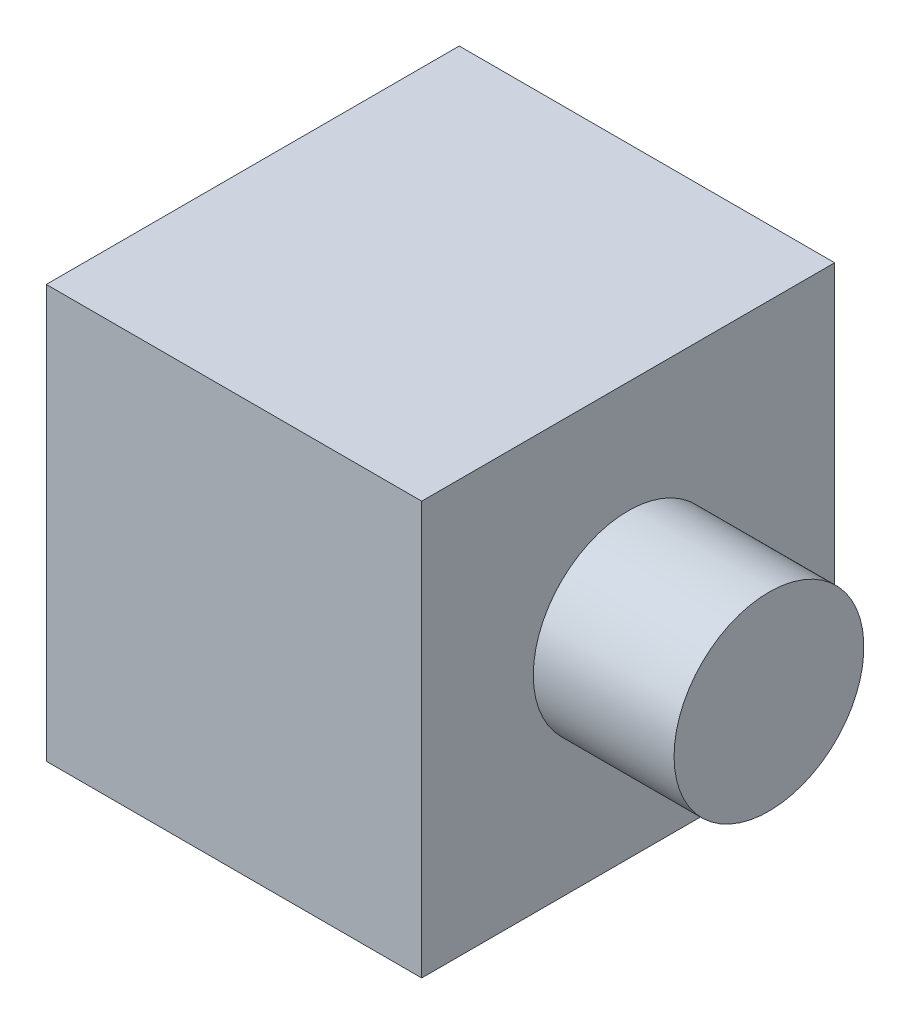
from build123d import *

# Parameters (mm, degrees)
BLOCK_SKETCH_W          = 40
BLOCK_SKETCH_H          = 44
BLOCK_DEPTH             = 22
NECK_SKETCH_W           = 15
NECK_SKETCH_H           = 10.1125
REGULATOR_PORT_SKETCH_W = 15
REGULATOR_PORT_SKETCH_H = 7.2
SIDE_PORT_Y_SKETCH_W    = 5.5
SIDE_PORT_Y_SKETCH_H    = 15


with BuildPart() as part:
    # Block Sketch → Block (new, symmetric)
    with BuildSketch(Plane.XY):
        with Locations((-20, 0)):
            Rectangle(BLOCK_SKETCH_W, BLOCK_SKETCH_H)
    extrude(amount=BLOCK_DEPTH, both=True)

    # Neck Sketch → Neck (revolve)
    with BuildSketch(Plane.XY):
        with Locations((7.5, 5.05625)):
            Rectangle(NECK_SKETCH_W, NECK_SKETCH_H)
    revolve(axis=Axis((-1000, 0, 0), (1, 0, 0)))

    # Regulator Port Sketch → Regulator Port (revolve, cut)
    with BuildSketch(Plane.XY):
        with Locations((-33.5, 3.6)):
            Rectangle(REGULATOR_PORT_SKETCH_W, REGULATOR_PORT_SKETCH_H)
    revolve(axis=Axis((-1000, 0, 0), (1, 0, 0)), mode=Mode.SUBTRACT)

    # Side Port -Y Sketch → Side Port -Y (revolve, cut)
    with BuildSketch(Plane.XY):
        with Locations((-17.25, -15.5)):
            Rectangle(SIDE_PORT_Y_SKETCH_W, SIDE_PORT_Y_SKETCH_H)
    revolve(axis=Axis((-20, -40, 0), (0, 1, 0)), mode=Mode.SUBTRACT)


solid = part.part
